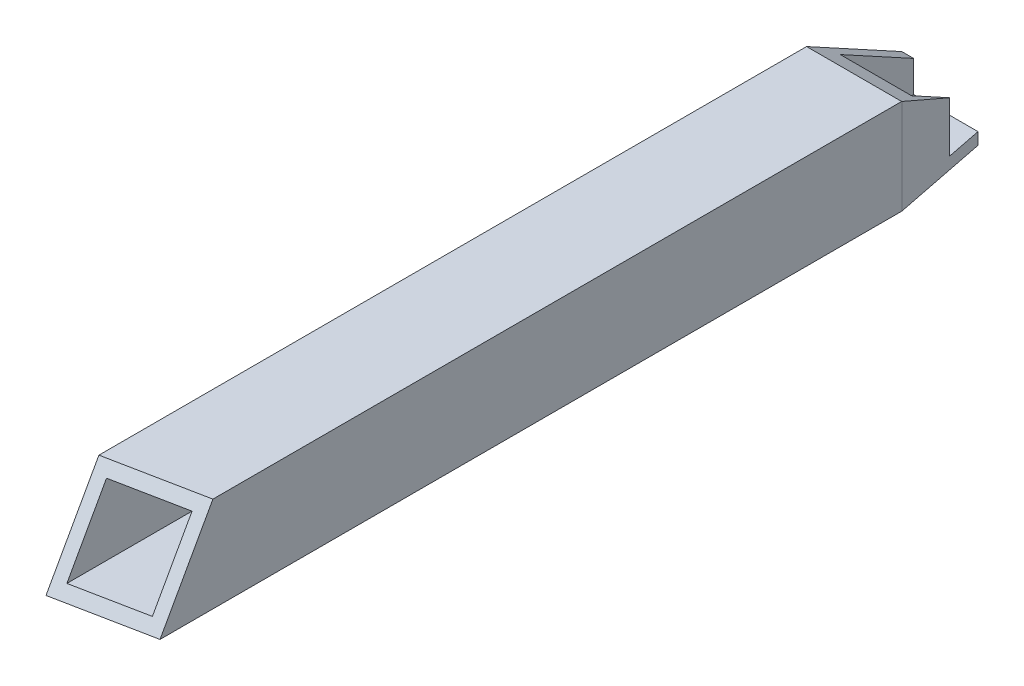
from build123d import *

# Parameters (mm, degrees)
BOSS_EXTRUDE1_DEPTH      = 114.3
BOSS_EXTRUDE1_DEPTH_BACK = 114.3
SKETCH3_W                = 25.4
SKETCH3_H                = 25.4
SKETCH3_W_2              = 19.05
SKETCH3_H_2              = 19.05


with BuildPart() as part:
    # Sketch3 → Boss-Extrude1 (new, two sides: drawn at the far end of the back side and taken through both)
    with BuildSketch(Plane.XY.offset(-BOSS_EXTRUDE1_DEPTH_BACK)):
        Rectangle(SKETCH3_W, SKETCH3_H)
        Rectangle(SKETCH3_W_2, SKETCH3_H_2, mode=Mode.SUBTRACT)
    extrude(amount=BOSS_EXTRUDE1_DEPTH + BOSS_EXTRUDE1_DEPTH_BACK)

    # SurfaceCut2
    split(bisect_by=Plane(origin=(15.454201301, 43.169818655, 77.622710273), x_dir=(0.9807512157806098, 0, -0.1952614983678451), z_dir=(0.17141995510435715, 0.47884508758591265, 0.8610009181684186)), keep=Keep.BOTTOM)

    # SurfaceCut4
    split(bisect_by=Plane(origin=(29.240398856, 0, -5.821582478), x_dir=(0, 1, 0), z_dir=(0.9807512157806096, 0, -0.19526149836784543)), keep=Keep.BOTTOM)

    # SurfaceCut5
    split(bisect_by=Plane(origin=(0, 47.140253483, -25.712374827), x_dir=(1, 0, 0), z_dir=(0, 0.8778994145657232, -0.47884508758591277)), keep=Keep.BOTTOM)


solid = part.part
